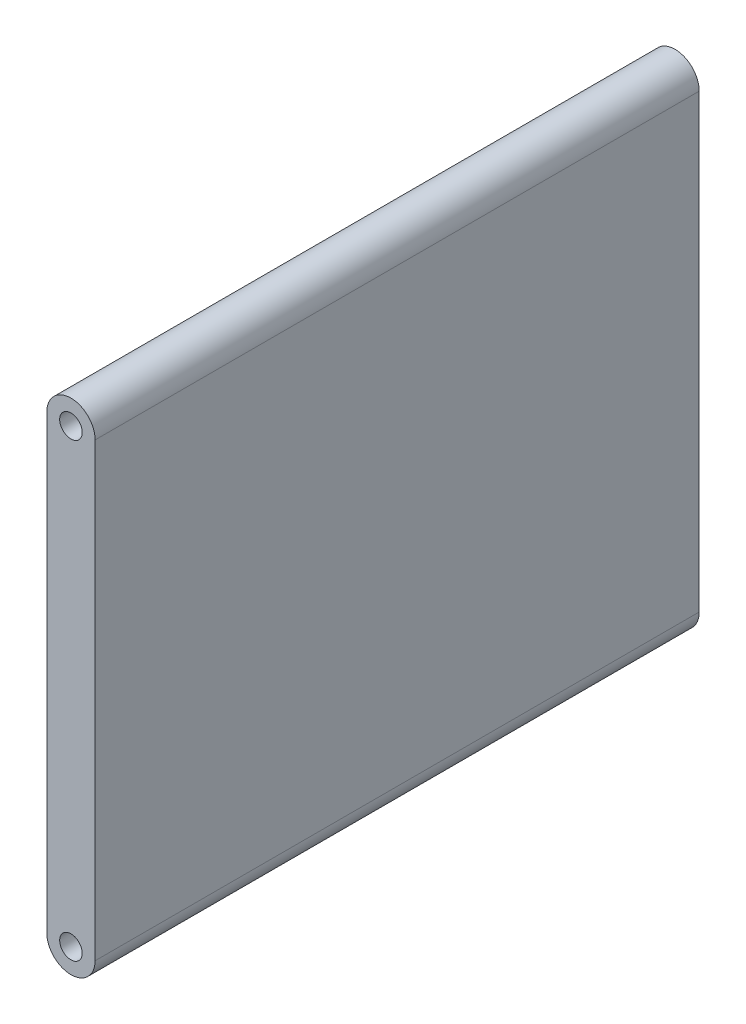
from build123d import *

# Parameters (mm, degrees)
CROQUIS1_R              = 1.4
SALIENTE_EXTRUIR1_DEPTH = 75


with BuildPart() as part:
    # Croquis1 → Saliente-Extruir1 (new body)
    with BuildSketch(Plane.XY):
        with BuildLine():
            Line((3, -28), (3, 28))
            ThreePointArc((3, 28), (0, 31), (-3, 28))
            Line((-3, 28), (-3, -28))
            ThreePointArc((-3, -28), (0, -31), (3, -28))
        make_face()
        with Locations((0, 28)):
            Circle(CROQUIS1_R, mode=Mode.SUBTRACT)
        with Locations((0, -28)):
            Circle(CROQUIS1_R, mode=Mode.SUBTRACT)
    extrude(amount=SALIENTE_EXTRUIR1_DEPTH)


solid = part.part
